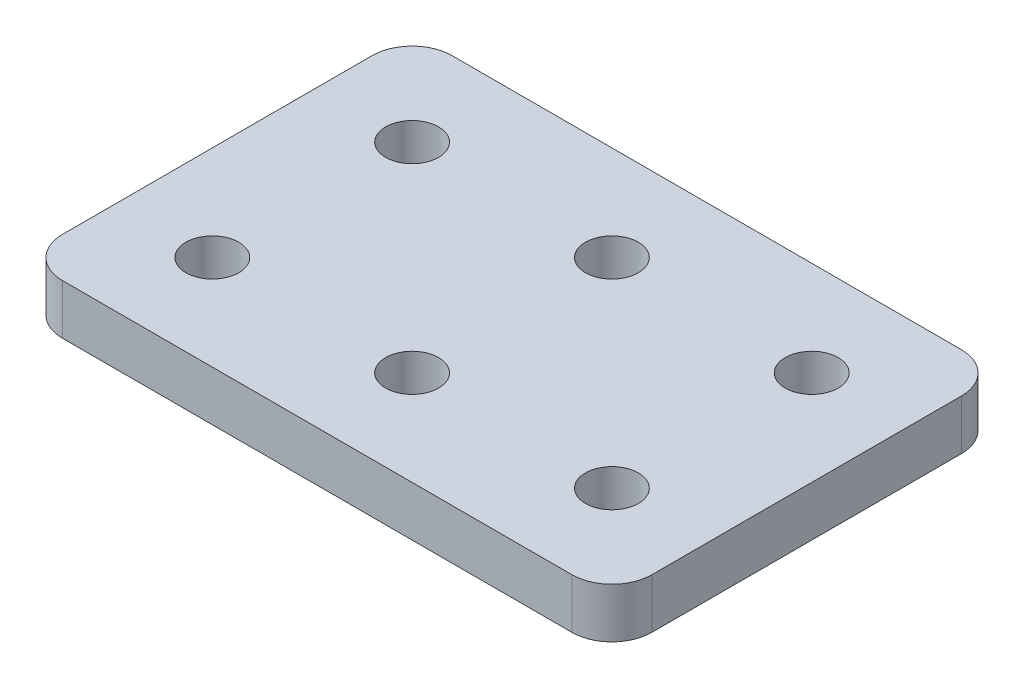
from build123d import *

# Parameters (mm, degrees)
F_4_HOLE_PROFILE_SKETCH_R        = 2.65
F_4_HOLE_THICKNESS_EXTRUDE_DEPTH = 5
F_6_HOLE_EXTENSION_SKETCH_R      = 2.65
F_6_HOLE_EXTENSION_EXTRUDE_DEPTH = 5


with BuildPart() as part:
    # 4 Hole Profile Sketch → 4 Hole Thickness Extrude (new body)
    with BuildSketch(Plane(origin=(0, 0, 0), x_dir=(1, 0, 0), z_dir=(0, 1, 0))):
        with BuildLine():
            Line((-15.5, -19.5), (15.5, -19.5))
            ThreePointArc((15.5, -19.5), (18.328427125, -18.328427125), (19.5, -15.5))
            Line((19.5, -15.5), (19.5, 15.5))
            ThreePointArc((19.5, 15.5), (18.328427125, 18.328427125), (15.5, 19.5))
            Line((15.5, 19.5), (-15.5, 19.5))
            ThreePointArc((-15.5, 19.5), (-18.328427125, 18.328427125), (-19.5, 15.5))
            Line((-19.5, 15.5), (-19.5, -15.5))
            ThreePointArc((-19.5, -15.5), (-18.328427125, -18.328427125), (-15.5, -19.5))
        make_face()
        with Locations(Location((10, -10, 0), (0, 0, 270))):
            Circle(F_4_HOLE_PROFILE_SKETCH_R, mode=Mode.SUBTRACT)
        with Locations(Location((10, 10, 0), (0, 0, 270))):
            Circle(F_4_HOLE_PROFILE_SKETCH_R, mode=Mode.SUBTRACT)
        with Locations(Location((-10, -10, 0), (0, 0, 270))):
            Circle(F_4_HOLE_PROFILE_SKETCH_R, mode=Mode.SUBTRACT)
        with Locations(Location((-10, 10, 0), (0, 0, 270))):
            Circle(F_4_HOLE_PROFILE_SKETCH_R, mode=Mode.SUBTRACT)
    extrude(amount=F_4_HOLE_THICKNESS_EXTRUDE_DEPTH)

    # 6 Hole Extension Sketch → 6 Hole Extension Extrude (add)
    with BuildSketch(Plane(origin=(0, 0, 0), x_dir=(1, 0, 0), z_dir=(0, 1, 0))):
        with BuildLine():
            Line((39.5, -15.5), (39.5, 15.5))
            ThreePointArc((39.5, 15.5), (38.328427125, 18.328427125), (35.5, 19.5))
            Line((35.5, 19.5), (15.5, 19.5))
            ThreePointArc((15.5, 19.5), (18.328427125, 18.328427125), (19.5, 15.5))
            Line((19.5, 15.5), (19.5, -15.5))
            ThreePointArc((19.5, -15.5), (18.328427125, -18.328427125), (15.5, -19.5))
            Line((15.5, -19.5), (35.5, -19.5))
            ThreePointArc((35.5, -19.5), (38.328427125, -18.328427125), (39.5, -15.5))
        make_face()
        with Locations(Location((30, -10, 0), (0, 0, 270))):
            Circle(F_6_HOLE_EXTENSION_SKETCH_R, mode=Mode.SUBTRACT)
        with Locations(Location((30, 10, 0), (0, 0, 270))):
            Circle(F_6_HOLE_EXTENSION_SKETCH_R, mode=Mode.SUBTRACT)
    extrude(amount=F_6_HOLE_EXTENSION_EXTRUDE_DEPTH)


solid = part.part
